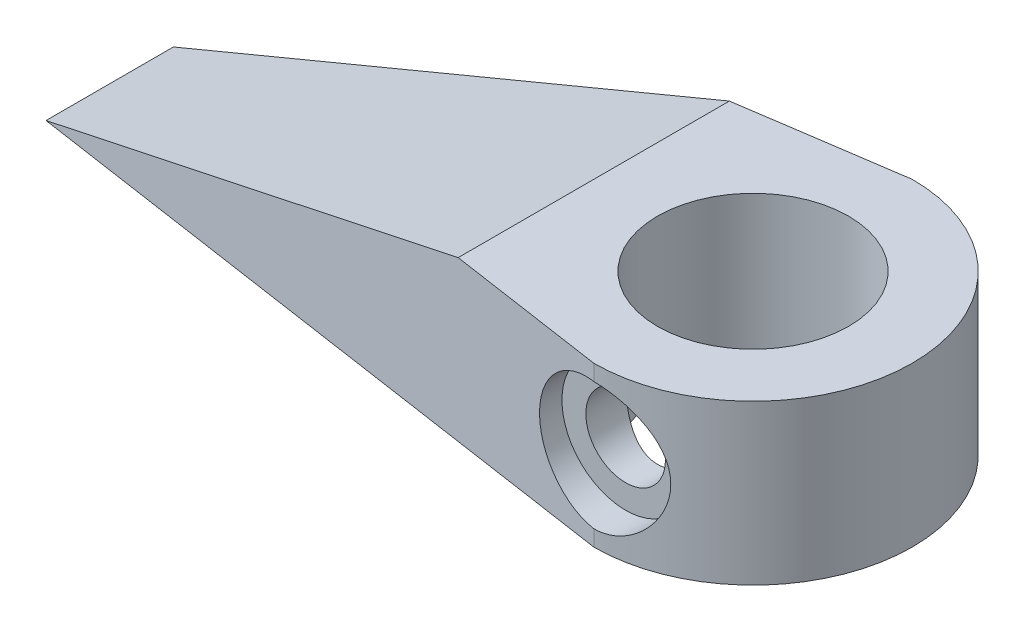
from build123d import *

# Parameters (mm, degrees)
BOSS_EXTRUDE4_DEPTH     = 4
BOSS_EXTRUDE6_DEPTH     = 5
CUT_EXTRUDE3_REACH      = 28.627
CUT_EXTRUDE2_REACH      = 28.627
SKETCH9_R               = 3
CUT_EXTRUDE4_REACH      = 29.568
CUT_EXTRUDE4_END_RADIUS = 3
SKETCH12_R              = 1.25
SKETCH13_R              = 2
CUT_EXTRUDE5_DEPTH      = 1


with BuildPart() as part:
    # Sketch1 → Boss-Extrude4 (new body)
    with BuildSketch(Plane.XY):
        Polygon((0, 0), (15.198684154, 5), (15.198684154, 0), align=None)
    extrude(amount=BOSS_EXTRUDE4_DEPTH)

    # Sketch7 → Boss-Extrude6 (add)
    with BuildSketch(Plane(origin=(0, 0, 0), x_dir=(1, 0, 0), z_dir=(0, 1, 0))):
        with BuildLine():
            Line((20.198684154, 3), (0, 0))
            Line((0, 0), (15.198684154, 0))
            Line((15.198684154, 0), (15.198684154, -4))
            Line((15.198684154, -4), (0, -4))
            Line((0, -4), (20.198684154, -7))
            ThreePointArc((20.198684154, -7), (25.198684154, -2), (20.198684154, 3))
        make_face()
    extrude(amount=BOSS_EXTRUDE6_DEPTH)

    # Sketch10 → Cut-Extrude3 (cut, up to next)
    with BuildSketch(Plane.XY, mode=Mode.PRIVATE) as cut_extrude3_sk1:
        Polygon((0, 0), (0, 5), (15.198684154, 5), align=None)
    cut_extrude3_tool1 = extrude(cut_extrude3_sk1.sketch, amount=-CUT_EXTRUDE3_REACH, mode=Mode.PRIVATE) & part.part
    cut_extrude3 = cut_extrude3_tool1.solids().sort_by_distance((5.066228, 3.333333, 0))[0]
    add(cut_extrude3, mode=Mode.SUBTRACT)

    # Sketch9 → Cut-Extrude2 (cut, up to next)
    with BuildSketch(Plane(origin=(0, 5, 0), x_dir=(1, 0, 0), z_dir=(0, 1, 0)), mode=Mode.PRIVATE) as cut_extrude2_sk1:
        with Locations(Location((20.198684154, -2, 0), (0, 0, 270))):
            Circle(SKETCH9_R)
    cut_extrude2_tool1 = extrude(cut_extrude2_sk1.sketch, amount=-CUT_EXTRUDE2_REACH, mode=Mode.PRIVATE) & part.part
    add(cut_extrude2_tool1.solids().sort_by_distance((20.198684, 5, 2))[0], mode=Mode.SUBTRACT)

    # Mirror1: Cut-Extrude3 across plane
    add(cut_extrude3.mirror(Plane.XY.offset(2)), mode=Mode.SUBTRACT)

    # Cut-Extrude4: up to this cylinder (the profile starts outside it)
    cut_extrude4_end = Plane(origin=(20.198684154, 2.5, 2), z_dir=(0, 1, 0)) * Cylinder(CUT_EXTRUDE4_END_RADIUS, 66.136, mode=Mode.PRIVATE)
    # Sketch12 → Cut-Extrude4 (cut, up to the surface)
    with BuildSketch(Plane.XY.offset(7), mode=Mode.PRIVATE) as cut_extrude4_sk1:
        with Locations(Location((20.198684154, 2.5, 0), (0, 0, 270))):
            Circle(SKETCH12_R)
    cut_extrude4_tool1 = extrude(cut_extrude4_sk1.sketch, amount=-CUT_EXTRUDE4_REACH, mode=Mode.PRIVATE) - cut_extrude4_end
    add(cut_extrude4_tool1.solids().sort_by_distance((20.198684, 2.5, 7))[0], mode=Mode.SUBTRACT)

    # Sketch13 → Cut-Extrude5 (cut)
    with BuildSketch(Plane.XY.offset(7)):
        with Locations((20.198684154, 2.5)):
            Circle(SKETCH13_R)
    extrude(amount=-CUT_EXTRUDE5_DEPTH, mode=Mode.SUBTRACT)


solid = part.part
